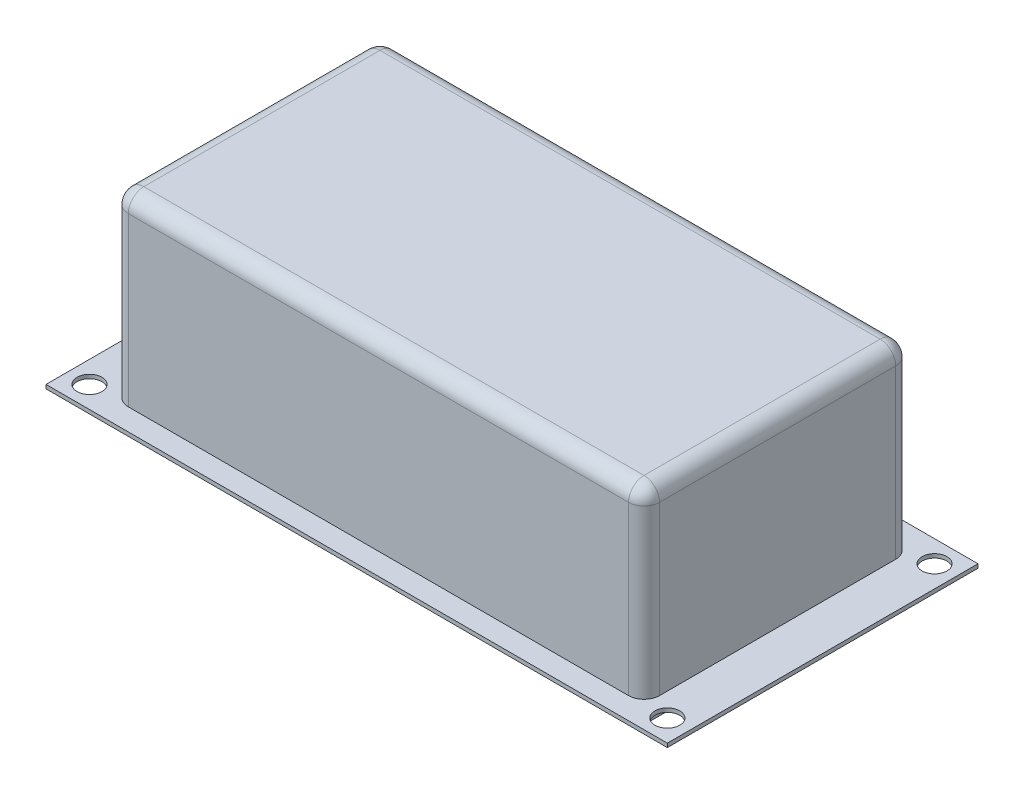
from build123d import *

# Parameters (mm, degrees)
SKETCH1_W               = 101.6
SKETCH1_H               = 50.8
BOSS_EXTRUDE1_DEPTH     = 0.3175
SKETCH2_R               = 2.032
CUT_EXTRUDE1_DEPTH      = 57.799676275
MIRROR2_COPY_1_SKETCH_R = 2.032
MIRROR2_COPY_1_DEPTH    = 57.799676275
SKETCH3_W               = 86.868
SKETCH3_H               = 43.688
BOSS_EXTRUDE2_DEPTH     = 2.54
SKETCH3_2_W             = 86.868
SKETCH3_2_H             = 43.688
BOSS_EXTRUDE3_DEPTH     = 30.226
FILLET1_R               = 2.54


with BuildPart() as part:
    # Sketch1 → Boss-Extrude1 (new, symmetric)
    with BuildSketch(Plane(origin=(0, 0, 0), x_dir=(1, 0, 0), z_dir=(0, 1, 0))):
        Rectangle(SKETCH1_W, SKETCH1_H)
    extrude(amount=BOSS_EXTRUDE1_DEPTH, both=True)

    # Sketch2 → Cut-Extrude1 (cut, through all)
    with BuildSketch(Plane(origin=(0, 0.3175, 0), x_dir=(1, 0, 0), z_dir=(0, 1, 0))):
        with Locations(Location((-47.244, -21.844, 0), (0, 0, 270))):
            Circle(SKETCH2_R)
    cut_extrude1 = extrude(amount=-CUT_EXTRUDE1_DEPTH, mode=Mode.SUBTRACT)

    # Mirror1: Cut-Extrude1 across plane
    add(cut_extrude1.mirror(Plane.XY), mode=Mode.SUBTRACT)

    # Mirror2: Cut-Extrude1 across plane
    add(cut_extrude1.mirror(Plane(origin=(0, 0, 0), x_dir=(0, 0, 1), z_dir=(1, 0, 0))), mode=Mode.SUBTRACT)

    # Mirror2 copy 1 sketch → Mirror2 copy 1 (cut, through all)
    with BuildSketch(Plane(origin=(0, 0.3175, 0), x_dir=(-1, 0, 0), z_dir=(0, 1, 0))):
        with Locations(Location((-47.244, -21.844, 0), (0, 0, 270))):
            Circle(MIRROR2_COPY_1_SKETCH_R)
    extrude(amount=-MIRROR2_COPY_1_DEPTH, mode=Mode.SUBTRACT)

    # Sketch3 → Boss-Extrude2 (add)
    with BuildSketch(Plane(origin=(0, 0, 0), x_dir=(1, 0, 0), z_dir=(0, 1, 0))):
        Rectangle(SKETCH3_W, SKETCH3_H)
    extrude(amount=-BOSS_EXTRUDE2_DEPTH)

    # Sketch3<2> → Boss-Extrude3 (add)
    with BuildSketch(Plane(origin=(0, 0, 0), x_dir=(1, 0, 0), z_dir=(0, 1, 0))):
        Rectangle(SKETCH3_2_W, SKETCH3_2_H)
    extrude(amount=BOSS_EXTRUDE3_DEPTH)

    # Fillet1
    fillet1_edges = [part.edges().sort_by_distance(p)[0] for p in [
        (43.434, 15.27175, 21.844),
        (43.434, 15.27175, -21.844),
        (-43.434, 15.27175, -21.844),
        (-43.434, 15.27175, 21.844),
        (43.434, 30.226, 0),
        (0, 30.226, -21.844),
        (-43.434, 30.226, 0),
        (0, 30.226, 21.844),
    ]]
    fillet(fillet1_edges, radius=FILLET1_R)


solid = part.part
